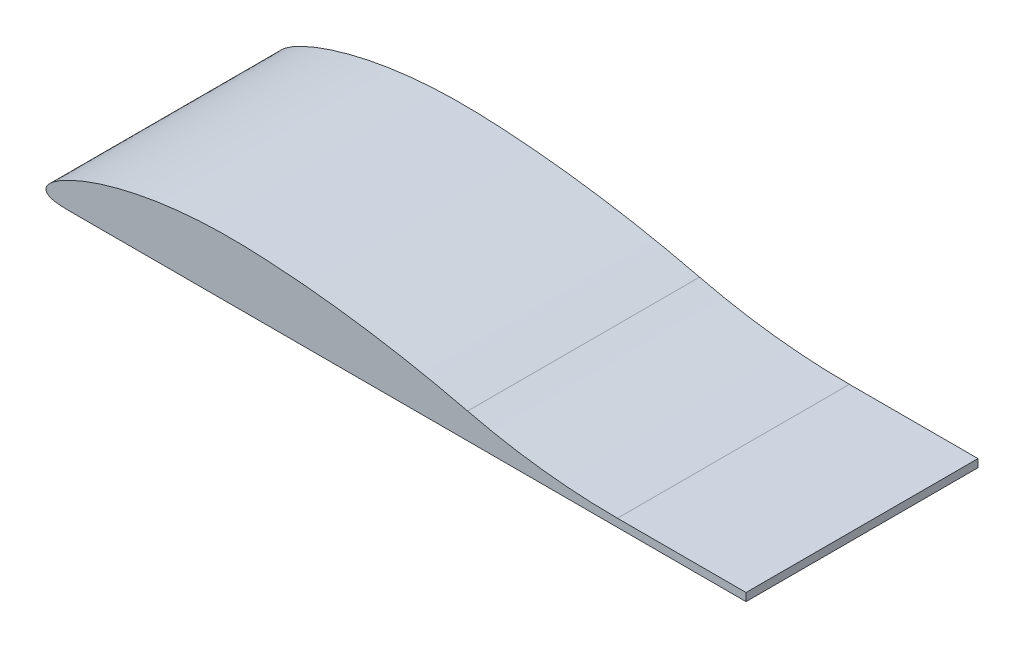
from build123d import *

# Parameters (mm, degrees)
BOSS_EXTRUDE1_DEPTH = 185.42
FILLET1_R           = 508


with BuildPart() as part:
    # Sketch1 → Boss-Extrude1 (new body)
    with BuildSketch(Plane.XY):
        with BuildLine():
            add(Edge.make_bspline(
                [(16.824486281, -3.584005936), (17.576425683, -3.584005936), (21.595703212, -3.543351385), (29.450687295, -3.173180462), (40.913314732, -2.231022297), (53.954734382, -0.933620653), (68.441844322, 0.603641829), (84.220077594, 2.261793956), (101.146412331, 3.900017255), (119.057408579, 5.371009548), (137.798850975, 6.573531856), (157.307672246, 7.348038209), (177.40159034, 7.753534803), (197.867291711, 8.106295079), (218.383935911, 8.253829905), (238.720913993, 8.211809333), (258.659276833, 7.955812655), (277.981187946, 7.500857289), (296.474222895, 6.863195832), (313.932531106, 6.083996751), (330.158311416, 5.198742586), (344.958833395, 4.265782532), (358.177232856, 3.324634453), (369.605973843, 2.442150407), (379.256357552, 1.633649638), (386.613193972, 1.003388636), (392.568540151, 0.420302648), (395.032189851, 0.27723258), (397.393838715, -0.038645243), (397.402740734, 0)],
                knots=[0.53121993, 0.53121993, 0.53121993, 0.53121993, 0.533991629, 0.546033957, 0.560220284, 0.576403357, 0.594370816, 0.613951104, 0.634916885, 0.657088503, 0.68022991, 0.704175481, 0.729090367, 0.754353776, 0.779667752, 0.80476012, 0.829359339, 0.85320871, 0.876041363, 0.897604065, 0.917662212, 0.93596986, 0.952309788, 0.966502759, 0.978350083, 0.987731492, 0.99451092, 0.998633933, 1, 1, 1, 1], degree=3))
            Line((16.824486281, -3.584005936), (558.8, -3.584005936))
            Line((558.8, -3.584005936), (558.8, 2.765994064))
            Line((558.8, 2.765994064), (388.527876564, 2.765994064))
            add(Edge.make_bspline(
                [(397.402740734, 0), (397.411698055, 0.03888532), (395.109063505, 0.667730493), (392.937979901, 1.437651493), (390.154580013, 2.277233064), (388.527876564, 2.765994064)],
                knots=[0, 0, 0, 0, 0.001374553, 0.005484497, 0.011464236, 0.011464236, 0.011464236, 0.011464236], degree=3))
        make_face()
        with BuildLine():
            add(Edge.make_bspline(
                [(397.402740734, 0), (397.411698055, 0.03888532), (395.109063505, 0.667730493), (392.784748718, 1.491991135), (387.04171407, 3.207972013), (379.954865, 5.356589699), (370.615780699, 8.058979559), (359.507412748, 11.143106331), (346.598869358, 14.543871375), (332.06110309, 18.128841799), (316.03889288, 21.806415505), (298.691944358, 25.449886624), (280.209065946, 28.958844329), (260.784413322, 32.227025229), (240.627196049, 35.159834098), (219.959471219, 37.677818053), (199.011497338, 39.711885338), (178.012037109, 41.180494444), (157.089436588, 42.139263372), (136.464680267, 42.213174939), (116.414649467, 41.217940478), (97.304330976, 39.298487784), (79.379986619, 36.549521344), (62.868119065, 33.114783487), (47.965554294, 29.173907116), (34.85097922, 24.899512861), (23.659260509, 20.503409457), (14.515298076, 16.132494214), (7.448223951, 12.010497642), (2.547126277, 8.168994228), (-0.453384309, 4.792791742), (-1.169561594, 1.105575296), (1.414868301, -1.604103887), (5.700982636, -2.840772697), (11.755524499, -3.574452069), (19.698764161, -3.632745796), (29.450687295, -3.173180462), (40.913314732, -2.231022297), (53.954734382, -0.933620653), (68.441844322, 0.603641829), (84.220077594, 2.261793956), (101.146412331, 3.900017255), (119.057408579, 5.371009548), (137.798850975, 6.573531856), (157.307672246, 7.348038209), (177.40159034, 7.753534803), (197.867291711, 8.106295079), (218.383935911, 8.253829905), (238.720913993, 8.211809333), (258.659276833, 7.955812655), (277.981187946, 7.500857289), (296.474222895, 6.863195832), (313.932531106, 6.083996751), (330.158311416, 5.198742586), (344.958833395, 4.265782532), (358.177232856, 3.324634453), (369.605973843, 2.442150407), (379.256357552, 1.633649638), (386.613193972, 1.003388636), (392.568540151, 0.420302648), (395.032189851, 0.27723258), (397.393838715, -0.038645243), (397.402740734, 0)],
                knots=[0, 0, 0, 0, 0.001374553, 0.005484497, 0.012273361, 0.021682196, 0.033580612, 0.047830743, 0.064305953, 0.082777332, 0.103063756, 0.124929017, 0.148149111, 0.172444695, 0.197572106, 0.223268881, 0.249227775, 0.275186209, 0.300900709, 0.326462938, 0.351222485, 0.374905859, 0.397269706, 0.418072414, 0.437079533, 0.454093094, 0.468919632, 0.481391712, 0.491447127, 0.499023571, 0.504293734, 0.507921918, 0.511539686, 0.516780528, 0.52421649, 0.533991629, 0.546033957, 0.560220284, 0.576403357, 0.594370816, 0.613951104, 0.634916885, 0.657088503, 0.68022991, 0.704175481, 0.729090367, 0.754353776, 0.779667752, 0.80476012, 0.829359339, 0.85320871, 0.876041363, 0.897604065, 0.917662212, 0.93596986, 0.952309788, 0.966502759, 0.978350083, 0.987731492, 0.99451092, 0.998633933, 1, 1, 1, 1], degree=3))
        make_face()
    extrude(amount=BOSS_EXTRUDE1_DEPTH)

    # Fillet1
    fillet1_edges = [part.edges().sort_by_distance(p)[0] for p in [
        (388.527876564, 2.765994064, 92.71),
    ]]
    fillet(fillet1_edges, radius=FILLET1_R)


solid = part.part
